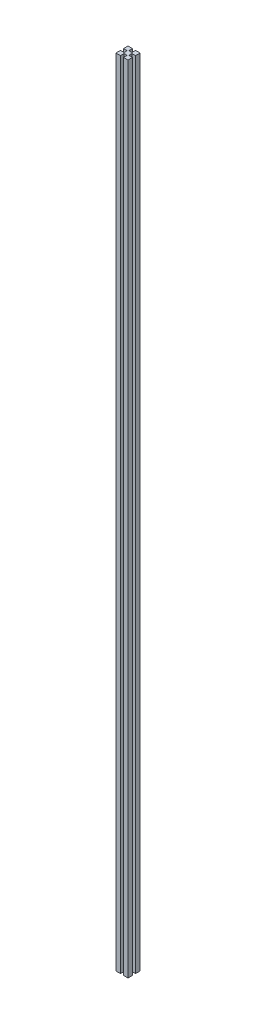
from build123d import *

# Parameters (mm, degrees)
BOSS_EXTRUDE1_DEPTH      = 656.463
BOSS_EXTRUDE1_DEPTH_BACK = 656.463
SKETCH1_W                = 20
SKETCH1_H                = 20
CUT_EXTRUDE1_DEPTH       = 657.61531384
CUT_EXTRUDE1_DEPTH_BACK  = 657.61531384
SKETCH2_W                = 5
SKETCH2_H                = 12
SKETCH2_W_2              = 12
SKETCH2_H_2              = 5


with BuildPart() as part:
    # Sketch1 → Boss-Extrude1 (new, two sides: drawn at the far end of the back side and taken through both)
    with BuildSketch(Plane(origin=(0, 0, 0), x_dir=(1, 0, 0), z_dir=(0, 1, 0)).offset(-BOSS_EXTRUDE1_DEPTH_BACK)):
        Rectangle(SKETCH1_W, SKETCH1_H)
    extrude(amount=BOSS_EXTRUDE1_DEPTH + BOSS_EXTRUDE1_DEPTH_BACK)

    # Sketch2 → Cut-Extrude1 (cut, two sides: drawn at the far end of the back side and taken through both)
    with BuildSketch(Plane(origin=(0, 0, 0), x_dir=(1, 0, 0), z_dir=(0, 1, 0)).offset(-CUT_EXTRUDE1_DEPTH_BACK)):
        with Locations((0, 10)):
            Rectangle(SKETCH2_W, SKETCH2_H)
        with Locations((10, 0)):
            Rectangle(SKETCH2_W_2, SKETCH2_H_2)
        with Locations((-10, 0)):
            Rectangle(SKETCH2_W_2, SKETCH2_H_2)
        with Locations((0, -10)):
            Rectangle(SKETCH2_W, SKETCH2_H)
    extrude(amount=CUT_EXTRUDE1_DEPTH + CUT_EXTRUDE1_DEPTH_BACK, mode=Mode.SUBTRACT)


solid = part.part
